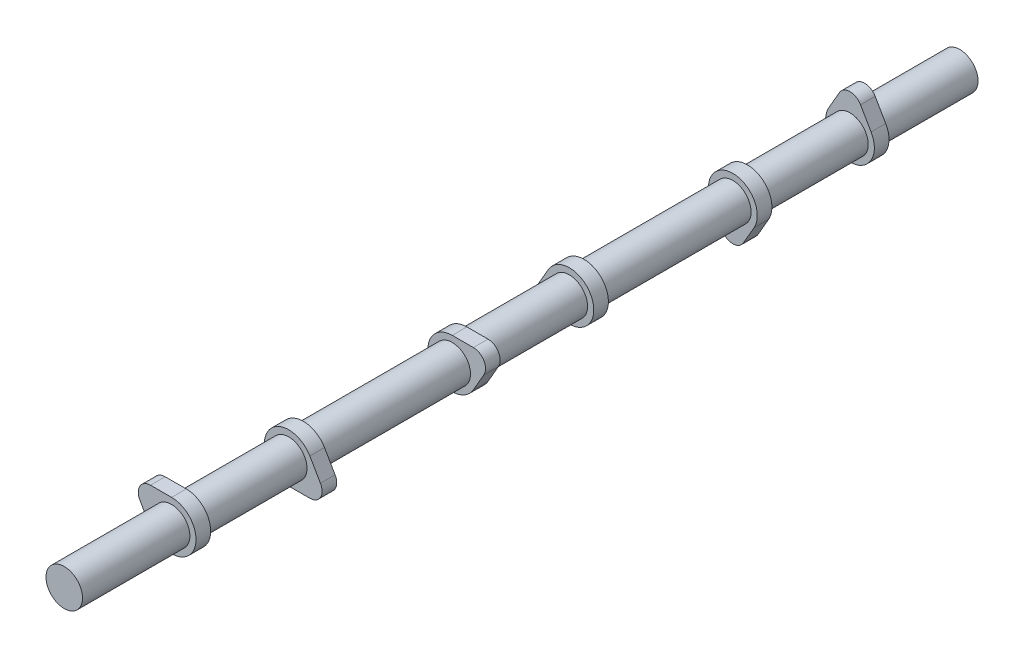
from build123d import *

# Parameters (mm, degrees)
BOSS_EXTRUDE1_DEPTH   = 3.81
LPATTERN1_COUNT       = 2
LPATTERN1_PITCH       = 60.96
BODY_MOVE_COPY1_ANGLE = 180
LPATTERN2_COUNT       = 3
LPATTERN2_PITCH       = 146.05
BODY_MOVE_COPY2_ANGLE = 120
BODY_MOVE_COPY3_ANGLE = 120
BOSS_EXTRUDE2_START   = 49.53
SKETCH2_R             = 9.5
BOSS_EXTRUDE2_DEPTH   = 466.09


with BuildPart() as part:
    # Sketch1 → Boss-Extrude1 (new, symmetric)
    with BuildSketch(Plane.XY):
        with BuildLine():
            Line((-5.499261314, 15.875), (-10.998522628, 6.35))
            ThreePointArc((-10.998522628, 6.35), (0, -12.7), (10.998522628, 6.35))
            Line((10.998522628, 6.35), (5.499261314, 15.875))
            ThreePointArc((5.499261314, 15.875), (0, 19.05), (-5.499261314, 15.875))
        make_face()
    extrude(amount=BOSS_EXTRUDE1_DEPTH, both=True)


with BuildPart() as lpattern1_1:
    # LPattern1: pattern copy
    add(part.part.moved(Location(Vector(0, 0, 1) * (1 * LPATTERN1_PITCH))))


with BuildPart() as lpattern1_1_1:
    # Body-Move/Copy1: moved
    add(lpattern1_1.part.rotate(Axis((0, 0, 0), (0, 0, 1)), BODY_MOVE_COPY1_ANGLE))


with BuildPart() as lpattern2_1:
    # LPattern2: pattern copy
    add(part.part.moved(Location(Vector(0, 0, 1) * (1 * LPATTERN2_PITCH))))


with BuildPart() as lpattern2_2:
    # LPattern2: pattern copy
    add(part.part.moved(Location(Vector(0, 0, 1) * (2 * LPATTERN2_PITCH))))


with BuildPart() as lpattern2_3:
    # LPattern2: pattern copy
    add(lpattern1_1_1.part.moved(Location(Vector(0, 0, 1) * (1 * LPATTERN2_PITCH))))


with BuildPart() as lpattern2_4:
    # LPattern2: pattern copy
    add(lpattern1_1_1.part.moved(Location(Vector(0, 0, 1) * (2 * LPATTERN2_PITCH))))


with BuildPart() as lpattern2_3_1:
    # Body-Move/Copy2: moved
    add(lpattern2_3.part.rotate(Axis((0, 0, 0), (0, 0, 1)), BODY_MOVE_COPY2_ANGLE))


with BuildPart() as lpattern2_1_1:
    # Body-Move/Copy2: moved
    add(lpattern2_1.part.rotate(Axis((0, 0, 0), (0, 0, 1)), BODY_MOVE_COPY2_ANGLE))


with BuildPart() as lpattern2_4_1:
    # Body-Move/Copy3: moved
    add(lpattern2_4.part.rotate(Axis((0, 0, 0), (0, 0, -1)), BODY_MOVE_COPY3_ANGLE))


with BuildPart() as lpattern2_2_1:
    # Body-Move/Copy3: moved
    add(lpattern2_2.part.rotate(Axis((0, 0, 0), (0, 0, -1)), BODY_MOVE_COPY3_ANGLE))


with BuildPart() as part_1:
    add(part.part)

    add(lpattern1_1_1.part)  # Boss-Extrude2 merges LPattern1_1

    add(lpattern2_1_1.part)  # Boss-Extrude2 merges LPattern2_1

    add(lpattern2_2_1.part)  # Boss-Extrude2 merges LPattern2_2

    add(lpattern2_3_1.part)  # Boss-Extrude2 merges LPattern2_3

    add(lpattern2_4_1.part)  # Boss-Extrude2 merges LPattern2_4
    # Sketch2 → Boss-Extrude2 (add)
    with BuildSketch(Plane(origin=(0, 0, -3.81), x_dir=(-1, 0, 0), z_dir=(0, 0, -1)).offset(BOSS_EXTRUDE2_START)):
        Circle(SKETCH2_R)
    extrude(amount=-BOSS_EXTRUDE2_DEPTH)


solid = part_1.part
